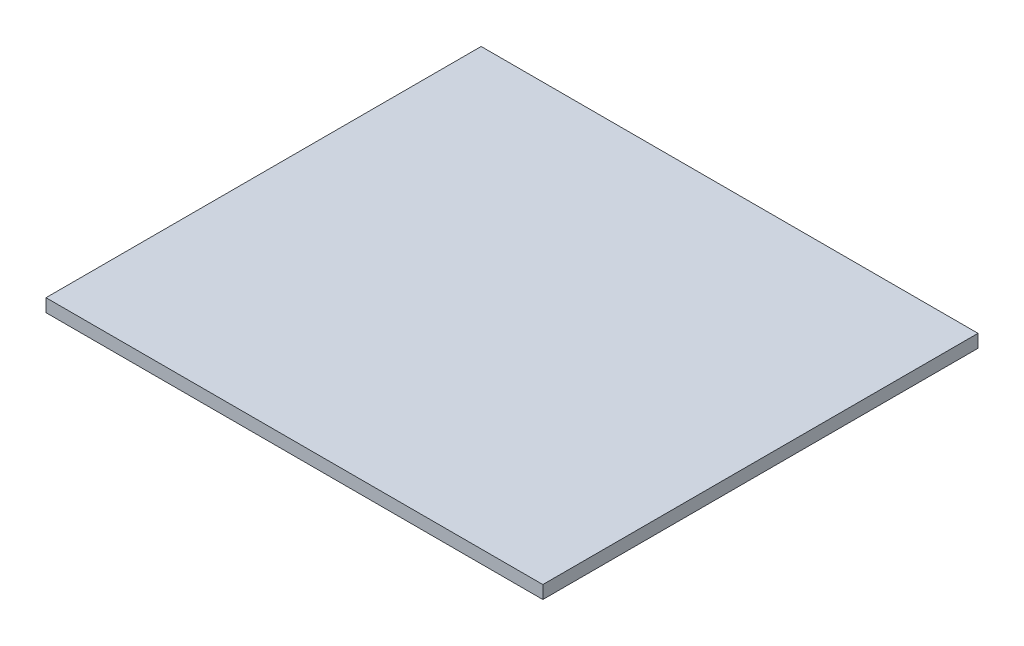
from build123d import *

# Parameters (mm, degrees)
SKETCH1_W           = 114.554
SKETCH1_H           = 100.33
BOSS_EXTRUDE1_DEPTH = 2.9972


with BuildPart() as part:
    # Sketch1 → Boss-Extrude1 (new body)
    with BuildSketch(Plane(origin=(0, 0, 0), x_dir=(1, 0, 0), z_dir=(0, 1, 0))):
        with Locations((57.277, -46.215)):
            Rectangle(SKETCH1_W, SKETCH1_H)
    extrude(amount=BOSS_EXTRUDE1_DEPTH)


solid = part.part
